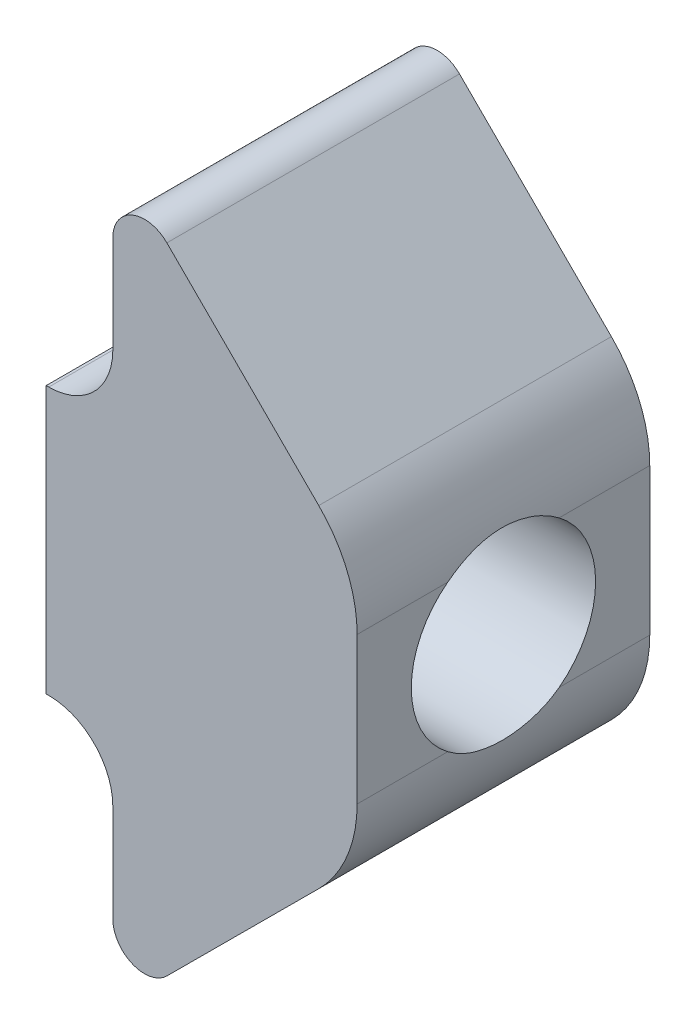
from build123d import *

# Parameters (mm, degrees)
BOSS_EXTRUDE1_DEPTH = 6.35
CUT_EXTRUDE1_REACH  = 13.666
SKETCH2_R           = 2
FILLET1_SIZE        = 0.4


with BuildPart() as part:
    # Sketch1 → Boss-Extrude1 (new body)
    with BuildSketch(Plane.XY):
        with BuildLine():
            Line((-11.5951, -2.898456882), (-11.5951, 2.898456882))
            Line((-11.5951, 2.898456882), (-11.539212407, 2.898456882))
            ThreePointArc((-11.539212407, 2.898456882), (-10.557032315, 3.305289197), (-10.1502, 4.287469289))
            Line((-10.1502, 4.287469289), (-10.1502, 6.402089023))
            ThreePointArc((-10.1502, 6.402089023), (-9.726213047, 7.037023378), (-8.977272455, 6.888717745))
            Line((-8.977272455, 6.888717745), (-5.681146941, 3.600125273))
            ThreePointArc((-5.681146941, 3.600125273), (-5.064922531, 2.679591066), (-4.8485, 1.593185507))
            Line((-4.8485, 1.593185507), (-4.8485, -1.593185507))
            ThreePointArc((-4.8485, -1.593185507), (-5.064922531, -2.679591066), (-5.681146941, -3.600125273))
            Line((-5.681146941, -3.600125273), (-8.977272455, -6.888717745))
            ThreePointArc((-8.977272455, -6.888717745), (-9.726213047, -7.037023378), (-10.1502, -6.402089023))
            Line((-10.1502, -6.402089023), (-10.1502, -4.287469289))
            ThreePointArc((-10.1502, -4.287469289), (-10.557032315, -3.305289197), (-11.539212407, -2.898456882))
            Line((-11.539212407, -2.898456882), (-11.5951, -2.898456882))
        make_face()
    extrude(amount=BOSS_EXTRUDE1_DEPTH)

    # Sketch2 → Cut-Extrude1 (cut, up to next)
    with BuildSketch(Plane.ZY.offset(11.5951), mode=Mode.PRIVATE) as cut_extrude1_sk1:
        with Locations((3.175, 0)):
            Circle(SKETCH2_R)
    cut_extrude1_tool1 = extrude(cut_extrude1_sk1.sketch, amount=-CUT_EXTRUDE1_REACH, mode=Mode.PRIVATE) & part.part
    add(cut_extrude1_tool1.solids().sort_by_distance((-11.5951, 0, 3.175))[0], mode=Mode.SUBTRACT)

    # Fillet1
    fillet1_edges = [part.edges().sort_by_distance(p)[0] for p in [
        (-11.5951, 0, 1.175),
    ]]
    chamfer(fillet1_edges, length=FILLET1_SIZE)


solid = part.part
